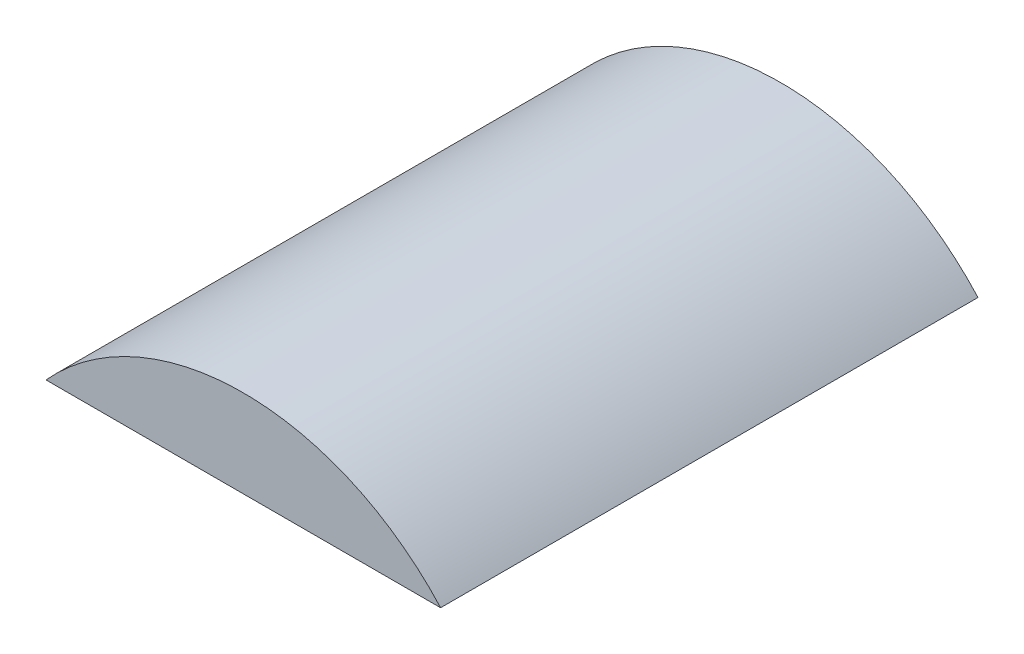
from build123d import *

# Parameters (mm, degrees)
BOSS_EXTRUDE1_DEPTH = 100


with BuildPart() as part:
    # Sketch1 → Boss-Extrude1 (new body)
    with BuildSketch(Plane.XY):
        with BuildLine():
            Line((36.715901224, 33.243999418), (-36.715901224, 33.243999418))
            ThreePointArc((-36.715901224, 33.243999418), (0, 49.53), (36.715901224, 33.243999418))
        make_face()
    extrude(amount=-BOSS_EXTRUDE1_DEPTH)


solid = part.part
